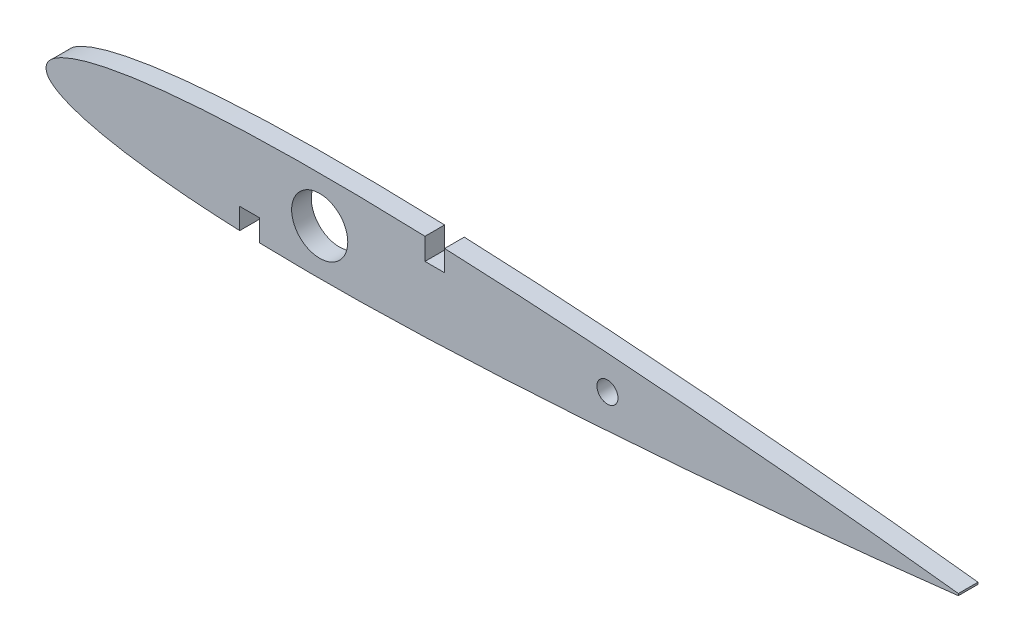
from build123d import *

# Parameters (mm, degrees)
SKETCH_1_R      = 4
SKETCH_1_R_2    = 1.5
EXTRUDE_1_DEPTH = 1.4


with BuildPart() as part:
    # Эскиз1 → Бобышка-Вытянуть1 (new, symmetric)
    # profile 1 of 3: a face of its own
    with BuildSketch(Plane.XY):
        with BuildLine():
            ThreePointArc((142.9506924, -5.275271304), (141.195386154, 0), (142.9506924, 5.275271304))
            add(Edge.make_bspline(
                [(142.9506924, 5.275271304), (141.895273265, 5.341555985), (139.58067118, 5.482611203), (136.018308787, 5.684139375), (132.278649951, 5.876462218), (129.209784139, 6.017194243), (127.3884169, 6.092546027), (126.8, 6.115995161)],
                knots=[0.434385904, 0.434385904, 0.434385904, 0.434385904, 0.458441906, 0.487136113, 0.515551917, 0.543623846, 0.557019782, 0.557019782, 0.557019782, 0.557019782], degree=3))
            Line((126.8, 6.115995161), (126.8, 3.115995161))
            Line((126.8, 3.115995161), (124, 3.115995161))
            Line((124, 3.115995161), (124, 6.220663768))
            add(Edge.make_bspline(
                [(124, 6.220663768), (123.11146317, 6.251630223), (121.050662796, 6.318359671), (117.842409031, 6.402489725), (114.402873354, 6.466317507), (111.045700994, 6.50076677), (107.777727309, 6.504988151), (104.605571578, 6.478227912), (101.535643119, 6.420092882), (98.574171232, 6.330224571), (95.72720364, 6.20862837), (93.000627425, 6.055460368), (90.400165433, 5.871109356), (87.93140692, 5.6561322), (85.599787172, 5.411383296), (83.410617303, 5.137791437), (81.369070337, 4.836509353), (79.480180392, 4.50879808), (77.748848327, 4.156021599), (76.179826925, 3.779610549), (74.777626787, 3.381064766), (73.546659786, 2.961752121), (72.490485221, 2.523001182), (71.613403941, 2.065704885), (70.914845437, 1.589483413), (70.405465138, 1.091288639), (70.065411578, 0.561470169), (70.021089193, 0.181022278), (70, 0)],
                knots=[0.578266104, 0.578266104, 0.578266104, 0.578266104, 0.59849081, 0.625169613, 0.651272029, 0.676746158, 0.701541791, 0.725611017, 0.748907835, 0.771387785, 0.793008139, 0.813728033, 0.833507815, 0.852309696, 0.87009731, 0.886835918, 0.902492782, 0.917037139, 0.930441054, 0.942679762, 0.953733567, 0.963589785, 0.972247019, 0.979722225, 0.986065145, 0.991385258, 0.995900989, 1, 1, 1, 1], degree=3))
            add(Edge.make_bspline(
                [(70, 0), (70.021089193, -0.181022278), (70.065411578, -0.561470169), (70.405465138, -1.091288639), (70.914845437, -1.589483413), (71.613403941, -2.065704885), (72.490485221, -2.523001182), (73.546659786, -2.961752121), (74.777626787, -3.381064766), (76.179826925, -3.779610549), (77.748848327, -4.156021599), (79.480180392, -4.50879808), (81.369070337, -4.836509353), (83.410617303, -5.137791437), (85.599787172, -5.411383296), (87.93140692, -5.6561322), (90.400165433, -5.871109356), (93.000627425, -6.055460368), (95.41524555, -6.191103829), (96.962536517, -6.260685275), (97.6, -6.286643263)],
                knots=[0, 0, 0, 0, 0.004099011, 0.008614742, 0.013934855, 0.020277775, 0.027752981, 0.036410215, 0.046266433, 0.057320238, 0.069558946, 0.082962861, 0.097507218, 0.113164082, 0.12990269, 0.147690304, 0.166492185, 0.186271967, 0.206991861, 0.221504823, 0.221504823, 0.221504823, 0.221504823], degree=3))
            Line((97.6, -6.286643263), (97.6, -3.286643263))
            Line((97.6, -3.286643263), (100.4, -3.286643263))
            Line((100.4, -3.286643263), (100.4, -6.38393598))
            add(Edge.make_bspline(
                [(100.4, -6.38393598), (100.766606381, -6.394566581), (102.157000483, -6.431859484), (104.605571578, -6.478227912), (107.777727309, -6.504988151), (111.045700994, -6.50076677), (114.402873354, -6.466317507), (117.842409031, -6.402489725), (121.357229156, -6.31032058), (124.940008831, -6.191027083), (128.583123626, -6.045931636), (132.278649951, -5.876462218), (136.018308787, -5.684139375), (139.58067118, -5.482611203), (141.895273265, -5.341555985), (142.9506924, -5.275271304)],
                knots=[0.242749132, 0.242749132, 0.242749132, 0.242749132, 0.251092165, 0.274388983, 0.298458209, 0.323253842, 0.348727971, 0.374830387, 0.40150919, 0.428710016, 0.456376154, 0.484448083, 0.512863887, 0.541558094, 0.565614096, 0.565614096, 0.565614096, 0.565614096], degree=3))
        make_face()
        with Locations((109, 0)):
            Circle(SKETCH_1_R, mode=Mode.SUBTRACT)
    # profile 2 of 3: a face of its own
    with BuildSketch(Plane.XY):
        with BuildLine():
            ThreePointArc((150, -4.804613846), (145.195386154, 0), (150, 4.804613846))
            add(Edge.make_bspline(
                [(150, 4.804613846), (149.136945561, 4.865512022), (147.000177515, 5.013425176), (144.650242252, 5.167974314), (143.163400263, 5.261912372), (142.9506924, 5.275271304)],
                knots=[0.380814152, 0.380814152, 0.380814152, 0.380814152, 0.400495752, 0.429537687, 0.434385904, 0.434385904, 0.434385904, 0.434385904], degree=3))
            ThreePointArc((142.9506924, 5.275271304), (141.195386154, 0), (142.9506924, -5.275271304))
            add(Edge.make_bspline(
                [(142.9506924, -5.275271304), (143.163400263, -5.261912372), (144.650242252, -5.167974314), (147.000177515, -5.013425176), (149.136945561, -4.865512022), (150, -4.804613846)],
                knots=[0.565614096, 0.565614096, 0.565614096, 0.565614096, 0.570462313, 0.599504248, 0.619185848, 0.619185848, 0.619185848, 0.619185848], degree=3))
        make_face()
    # profile 3 of 3: a face of its own
    with BuildSketch(Plane.XY):
        with BuildLine():
            Line((200, -0.1365), (200, 0.1365))
            add(Edge.make_bspline(
                [(200, 0.1365), (199.68803342, 0.172881569), (198.81669122, 0.27449757), (197.235914613, 0.456098486), (195.145010046, 0.692291497), (192.701519493, 0.962451868), (189.981579718, 1.256111468), (187.036509642, 1.566007991), (183.904963565, 1.886673282), (179.441732645, 2.330723386), (174.819068239, 2.769921708), (170.064960651, 3.20022732), (166.382173561, 3.522091337), (162.644406173, 3.836797902), (158.865943793, 4.14237985), (155.059961592, 4.437010481), (152.101523013, 4.655245952), (150.413140573, 4.775462142), (150, 4.804613846)],
                knots=[0, 0, 0, 0, 0.007144724, 0.019955661, 0.036196061, 0.055011184, 0.075878938, 0.098428866, 0.122375554, 0.147487885, 0.200459747, 0.22800517, 0.256076454, 0.284555151, 0.313332763, 0.342309554, 0.371392651, 0.380814152, 0.380814152, 0.380814152, 0.380814152], degree=3))
            ThreePointArc((150, 4.804613846), (145.195386154, 0), (150, -4.804613846))
            add(Edge.make_bspline(
                [(150, -4.804613846), (150.413140573, -4.775462142), (152.101523013, -4.655245952), (155.059961592, -4.437010481), (158.865943793, -4.14237985), (162.644406173, -3.836797902), (166.382173561, -3.522091337), (170.064960651, -3.20022732), (174.819068239, -2.769921708), (179.441732645, -2.330723386), (183.904963565, -1.886673282), (187.036509642, -1.566007991), (189.981579718, -1.256111468), (192.701519493, -0.962451868), (195.145010046, -0.692291497), (197.235914613, -0.456098486), (198.81669122, -0.27449757), (199.68803342, -0.172881569), (200, -0.1365)],
                knots=[0.619185848, 0.619185848, 0.619185848, 0.619185848, 0.628607349, 0.657690446, 0.686667237, 0.715444849, 0.743923546, 0.77199483, 0.799540253, 0.852512115, 0.877624446, 0.901571134, 0.924121062, 0.944988816, 0.963803939, 0.980044339, 0.992855276, 1, 1, 1, 1], degree=3))
        make_face()
        with Locations((150, 0)):
            Circle(SKETCH_1_R_2, mode=Mode.SUBTRACT)
    extrude(amount=EXTRUDE_1_DEPTH, both=True)


solid = part.part
